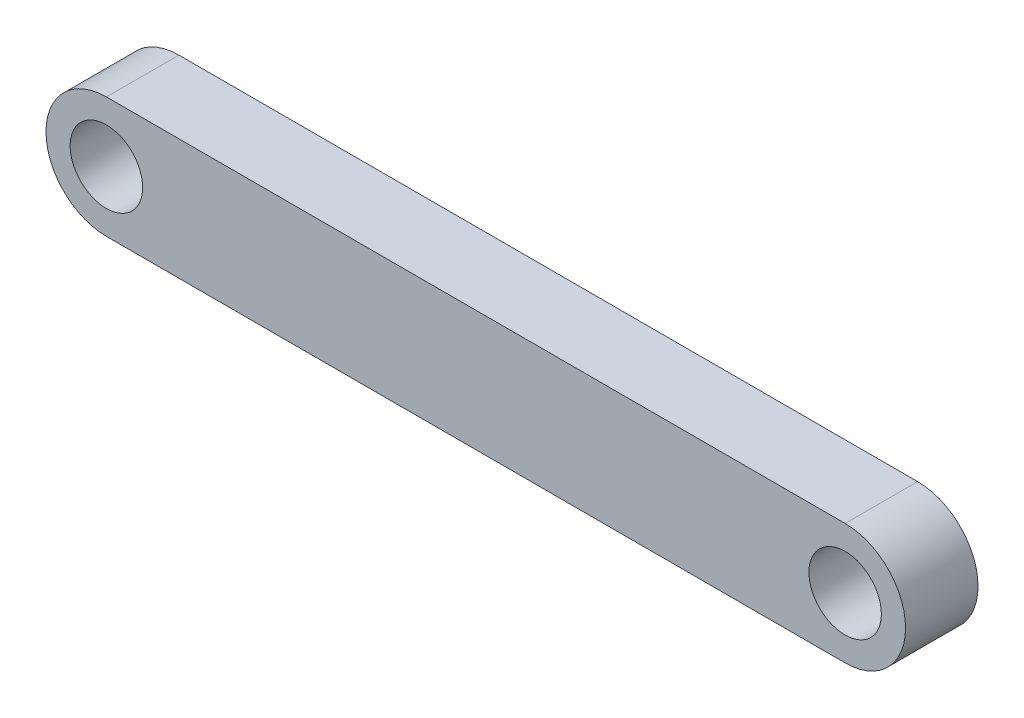
from build123d import *

# Parameters (mm, degrees)
ESQUISSE1_R        = 1.5
BOSS_EXTRU_1_DEPTH = 3


with BuildPart() as part:
    # Esquisse1 → Boss.-Extru.1 (new body)
    with BuildSketch(Plane.XY):
        with BuildLine():
            Line((0, 2.5), (30.58, 2.5))
            ThreePointArc((30.58, 2.5), (33.08, 0), (30.58, -2.5))
            Line((30.58, -2.5), (0, -2.5))
            ThreePointArc((0, -2.5), (-2.5, 0), (0, 2.5))
        make_face()
        Circle(ESQUISSE1_R, mode=Mode.SUBTRACT)
        with Locations((30.58, 0)):
            Circle(ESQUISSE1_R, mode=Mode.SUBTRACT)
    extrude(amount=BOSS_EXTRU_1_DEPTH)


solid = part.part
